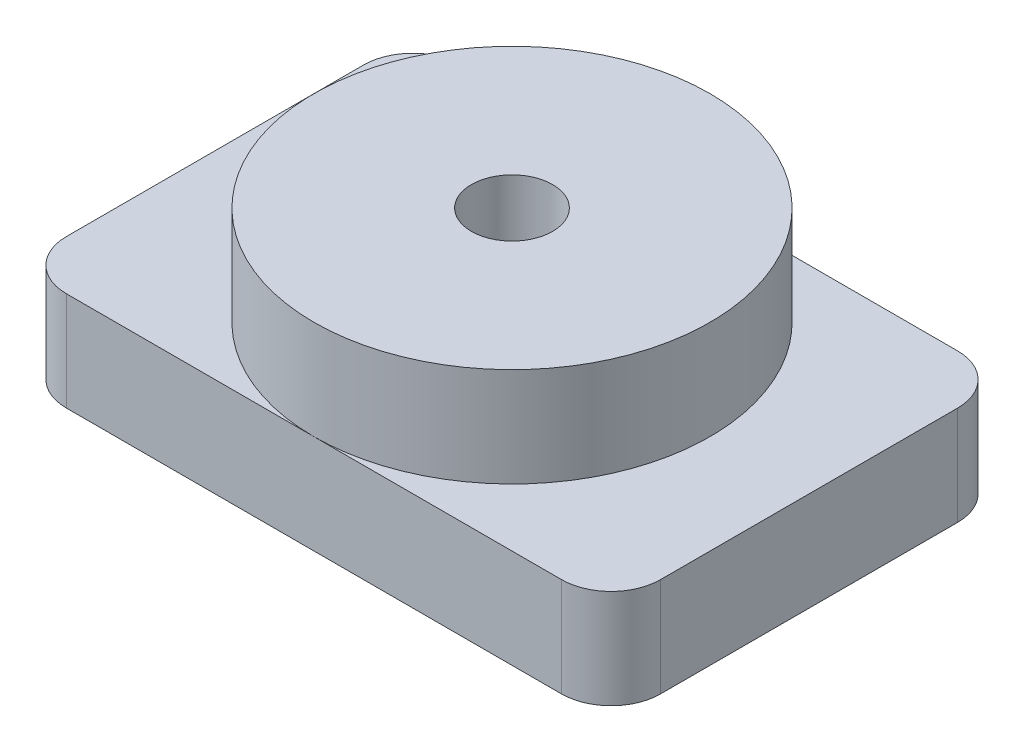
from build123d import *

# Parameters (mm, degrees)
SKETCH1_W           = 60
SKETCH1_H           = 40
BOSS_EXTRUDE1_DEPTH = 10
SKETCH2_R           = 20
BOSS_EXTRUDE2_DEPTH = 10
SKETCH4_R           = 4.1
CUT_EXTRUDE1_DEPTH  = 42.231056256
FILLET1_R           = 5
CUT_EXTRUDE2_DEPTH  = 7


with BuildPart() as part:
    # Sketch1 → Boss-Extrude1 (new body)
    with BuildSketch(Plane(origin=(0, 0, 0), x_dir=(1, 0, 0), z_dir=(0, 1, 0))):
        Rectangle(SKETCH1_W, SKETCH1_H)
    extrude(amount=BOSS_EXTRUDE1_DEPTH)

    # Sketch2 → Boss-Extrude2 (add)
    with BuildSketch(Plane(origin=(0, 10, 0), x_dir=(1, 0, 0), z_dir=(0, 1, 0))):
        with Locations(Location((0, 0, 0), (0, 0, 270))):
            Circle(SKETCH2_R)
    extrude(amount=BOSS_EXTRUDE2_DEPTH)

    # Sketch4 → Cut-Extrude1 (cut, through all)
    with BuildSketch(Plane(origin=(0, 20, 0), x_dir=(1, 0, 0), z_dir=(0, 1, 0))):
        with Locations(Location((0, 0, 0), (0, 0, 270))):
            Circle(SKETCH4_R)
    extrude(amount=-CUT_EXTRUDE1_DEPTH, mode=Mode.SUBTRACT)

    # Fillet1
    fillet1_edges = [part.edges().sort_by_distance(p)[0] for p in [
        (-30, 5, -20),
        (30, 5, -20),
        (30, 5, 20),
        (-30, 5, 20),
    ]]
    fillet(fillet1_edges, radius=FILLET1_R)

    # Sketch5 → Cut-Extrude2 (cut)
    with BuildSketch(Plane.XZ):
        Polygon((-7.67875858, 0), (-3.83937929, -6.65), (3.83937929, -6.65), (7.67875858, 0), (3.83937929, 6.65), (-3.83937929, 6.65), align=None)
    extrude(amount=-CUT_EXTRUDE2_DEPTH, mode=Mode.SUBTRACT)


solid = part.part
